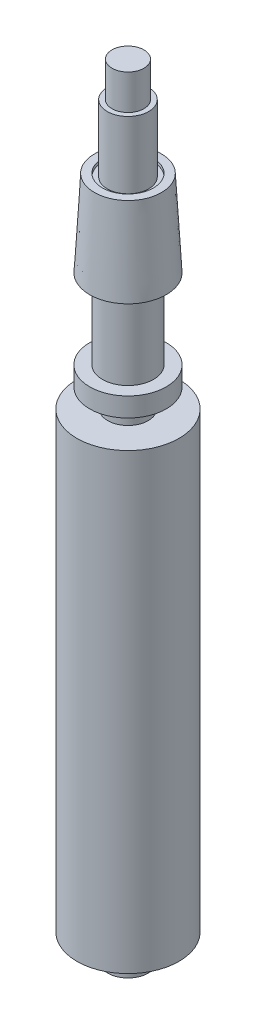
from build123d import *


with BuildPart() as part:
    # Çizim1 → Döndür1 (revolve)
    with BuildSketch(Plane.XY, mode=Mode.PRIVATE) as d_nd_r1_sk:
        Polygon((0, 0), (5, 0), (5, -11), (6.5, -11), (6.5, -32), (8, -32), (8, -31), (10.5, -31), (12, -58), (8, -58), (8, -83), (12, -83), (12, -89), (6.365949077, -89), (6.365949077, -95), (16, -95), (16, -237), (6.365949077, -237), (6.365949077, -245), (0, -245), align=None)
    revolve(d_nd_r1_sk.sketch.rotate(Axis((0, 0, 0), (0, -1, 0)), 90), axis=Axis((0, 0, 0), (0, -1, 0)))


solid = part.part
